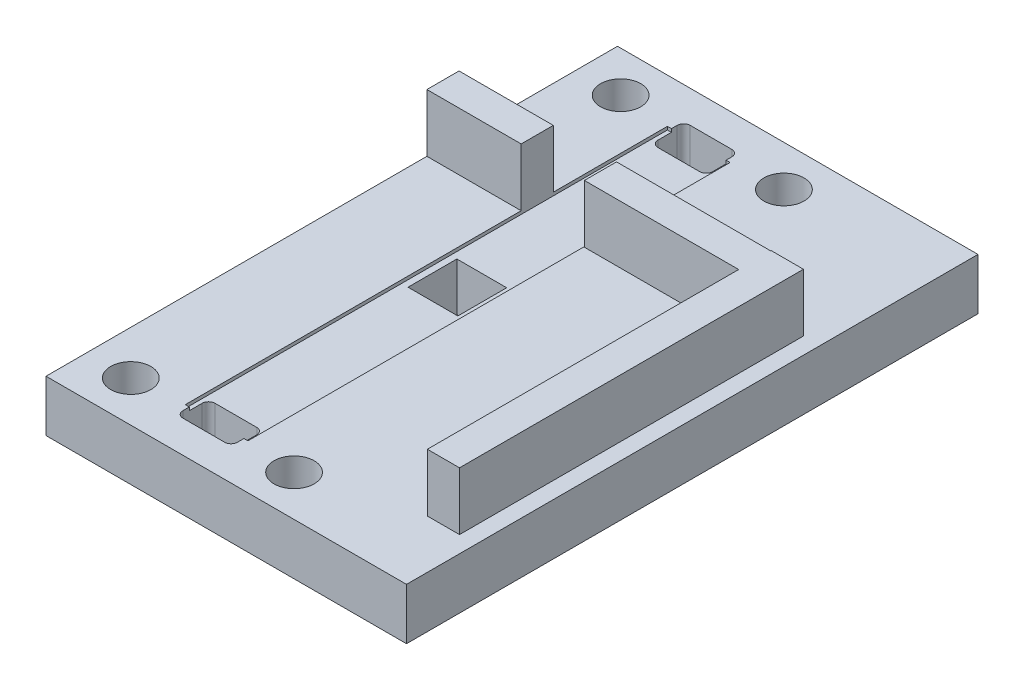
from build123d import *

# Parameters (mm, degrees)
SKETCH1_W               = 192.857142858
SKETCH1_H               = 177.8
BOSS_EXTRUDE1_DEPTH     = 16
SKETCH3_R               = 6.25
CUT_EXTRUDE1_DEPTH      = 12.7
CUT_EXTRUDE2_DEPTH      = 133.12751185
CUT_EXTRUDE2_DEPTH_BACK = 133.12751185
SKETCH6_R               = 3.5
CUT_EXTRUDE3_DEPTH      = 133.12751185
CUT_EXTRUDE3_DEPTH_BACK = 133.12751185
SKETCH7_W               = 15.5
SKETCH7_H               = 15.2
SKETCH17_W              = 58.35
SKETCH17_H              = 177.8
CUT_EXTRUDE10_DEPTH     = 133.12751185
SKETCH18_W              = 17
SKETCH18_H              = 10
CUT_EXTRUDE11_DEPTH     = 99.419229548
FILLET1_R               = 2
SKETCH19_W              = 48
SKETCH19_H              = 10
BOSS_EXTRUDE2_DEPTH     = 18
SKETCH20_W              = 177.8
SKETCH20_H              = 16
BOSS_EXTRUDE3_DEPTH     = 35
SKETCH21_W              = 10
SKETCH21_H              = 107
BOSS_EXTRUDE4_DEPTH     = 18
SKETCH23_W              = 17
SKETCH23_H              = 10
CUT_EXTRUDE12_DEPTH     = 30
FILLET2_R               = 2
SKETCH22_W              = 19.5
SKETCH22_H              = 150
CUT_EXTRUDE13_DEPTH     = 1
SKETCH24_W              = 29.328571429
SKETCH24_H              = 10
BOSS_EXTRUDE5_DEPTH     = 18


with BuildPart() as part:
    # Sketch1 → Boss-Extrude1 (new body)
    with BuildSketch(Plane(origin=(0, 0, 0), x_dir=(1, 0, 0), z_dir=(0, 1, 0))):
        Rectangle(SKETCH1_W, SKETCH1_H)
    extrude(amount=BOSS_EXTRUDE1_DEPTH)

    # Sketch3 → Cut-Extrude1 (cut)
    with BuildSketch(Plane(origin=(0, 16, 0), x_dir=(1, 0, 0), z_dir=(0, 1, 0))):
        with Locations(Location((-25.4, 76.2, 0), (0, 0, 270))):
            Circle(SKETCH3_R)
        with Locations(Location((25.4, 76.2, 0), (0, 0, 270))):
            Circle(SKETCH3_R)
        with Locations(Location((25.4, -76.2, 0), (0, 0, 90))):
            Circle(SKETCH3_R)
        with Locations(Location((-25.4, -76.2, 0), (0, 0, 90))):
            Circle(SKETCH3_R)
    extrude(amount=-CUT_EXTRUDE1_DEPTH, mode=Mode.SUBTRACT)

    # Sketch6 → Cut-Extrude2 (cut, two sides: drawn at the far end of the back side and taken through both)
    with BuildSketch(Plane(origin=(0, 0, 0), x_dir=(-1, 0, 0), z_dir=(0, -1, 0)).offset(-CUT_EXTRUDE2_DEPTH_BACK)):
        with Locations(Location((25.4, -76.2, 0), (0, 0, 90))):
            Circle(SKETCH6_R)
        with Locations(Location((-25.4, -76.2, 0), (0, 0, 90))):
            Circle(SKETCH6_R)
        with Locations(Location((-25.4, 76.2, 0), (0, 0, 270))):
            Circle(SKETCH6_R)
        with Locations(Location((25.4, 76.2, 0), (0, 0, 270))):
            Circle(SKETCH6_R)
    extrude(amount=CUT_EXTRUDE2_DEPTH + CUT_EXTRUDE2_DEPTH_BACK, mode=Mode.SUBTRACT)

    # Sketch7 → Cut-Extrude3 (cut, two sides: drawn at the far end of the back side and taken through both)
    with BuildSketch(Plane(origin=(0, 16, 0), x_dir=(1, 0, 0), z_dir=(0, 1, 0)).offset(-CUT_EXTRUDE3_DEPTH_BACK)):
        Rectangle(SKETCH7_W, SKETCH7_H)
    extrude(amount=CUT_EXTRUDE3_DEPTH + CUT_EXTRUDE3_DEPTH_BACK, mode=Mode.SUBTRACT)

    # Sketch17 → Cut-Extrude10 (cut, symmetric)
    with BuildSketch(Plane(origin=(0, 16, 0), x_dir=(1, 0, 0), z_dir=(0, 1, 0))):
        with Locations((67.253571429, 0)):
            Rectangle(SKETCH17_W, SKETCH17_H)
    cut_extrude10 = extrude(amount=CUT_EXTRUDE10_DEPTH, both=True, mode=Mode.SUBTRACT)

    # Mirror5: Cut-Extrude10 across plane
    add(cut_extrude10.mirror(Plane(origin=(-0.5, 0, 0), x_dir=(0, 0, 1), z_dir=(1, 0, 0))), mode=Mode.SUBTRACT)

    # Sketch18 → Cut-Extrude11 (cut, through all)
    with BuildSketch(Plane(origin=(0, 16, 0), x_dir=(1, 0, 0), z_dir=(0, 1, 0))):
        with Locations((0, -73.9)):
            Rectangle(SKETCH18_W, SKETCH18_H)
    extrude(amount=-CUT_EXTRUDE11_DEPTH, mode=Mode.SUBTRACT)

    # Fillet1
    fillet1_edges = [part.edges().sort_by_distance(p)[0] for p in [
        (-8.5, 8, 78.9),
        (-8.5, 8, 68.9),
        (8.5, 8, 68.9),
        (8.5, 8, 78.9),
    ]]
    fillet(fillet1_edges, radius=FILLET1_R)

    # Sketch19 → Boss-Extrude2 (add)
    with BuildSketch(Plane(origin=(0, 16, 0), x_dir=(1, 0, 0), z_dir=(0, 1, 0))):
        with Locations((33.921428571, 34.6)):
            Rectangle(SKETCH19_W, SKETCH19_H)
    extrude(amount=BOSS_EXTRUDE2_DEPTH)

    # Sketch20 → Boss-Extrude3 (add)
    with BuildSketch(Plane(origin=(38.078571429, 0, 0), x_dir=(0, 0, -1), z_dir=(1, 0, 0))):
        with Locations((0, 8)):
            Rectangle(SKETCH20_W, SKETCH20_H)
    extrude(amount=BOSS_EXTRUDE3_DEPTH)

    # Sketch21 → Boss-Extrude4 (add)
    with BuildSketch(Plane(origin=(0, 16, 0), x_dir=(1, 0, 0), z_dir=(0, 1, 0))):
        with Locations((62.921428571, -13.75)):
            Rectangle(SKETCH21_W, SKETCH21_H)
    extrude(amount=BOSS_EXTRUDE4_DEPTH)

    # Sketch23 → Cut-Extrude12 (cut)
    with BuildSketch(Plane(origin=(0, 16, 0), x_dir=(1, 0, 0), z_dir=(0, 1, 0))):
        with Locations((0, 73.9)):
            Rectangle(SKETCH23_W, SKETCH23_H)
    extrude(amount=-CUT_EXTRUDE12_DEPTH, mode=Mode.SUBTRACT)

    # Fillet2
    fillet2_edges = [part.edges().sort_by_distance(p)[0] for p in [
        (-8.5, 8, -68.9),
        (-8.5, 8, -78.9),
        (8.5, 8, -78.9),
        (8.5, 8, -68.9),
    ]]
    fillet(fillet2_edges, radius=FILLET2_R)

    # Sketch22 → Cut-Extrude13 (cut)
    with BuildSketch(Plane(origin=(0, 16, 0), x_dir=(1, 0, 0), z_dir=(0, 1, 0))):
        with Locations((0, 0.096227078)):
            Rectangle(SKETCH22_W, SKETCH22_H)
    extrude(amount=-CUT_EXTRUDE13_DEPTH, mode=Mode.SUBTRACT)

    # Sketch24 → Boss-Extrude5 (add)
    with BuildSketch(Plane(origin=(0, 16, 0), x_dir=(1, 0, 0), z_dir=(0, 1, 0))):
        with Locations((-24.414285715, 34.6)):
            Rectangle(SKETCH24_W, SKETCH24_H)
    extrude(amount=BOSS_EXTRUDE5_DEPTH)


solid = part.part
